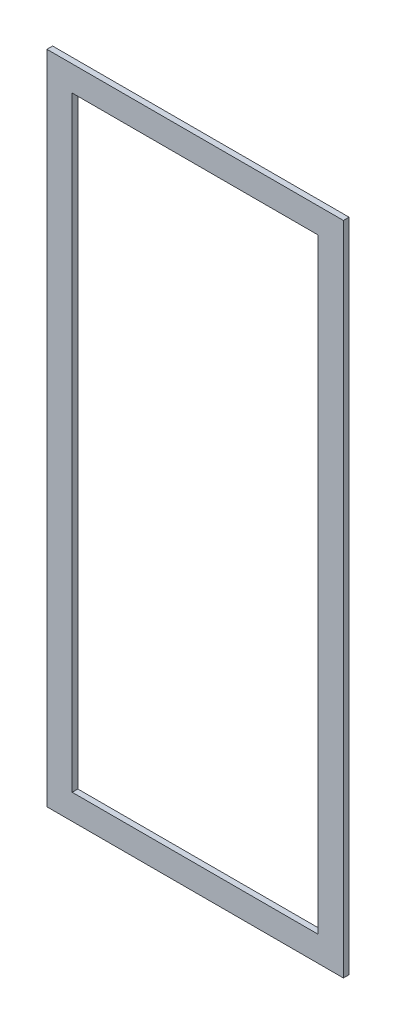
from build123d import *

# Parameters (mm, degrees)
ESBO_O1_W                = 94
ESBO_O1_H                = 208
ESBO_O1_W_2              = 78
ESBO_O1_H_2              = 192
RESSALTO_EXTRUS_O1_DEPTH = 1.8


with BuildPart() as part:
    # Esboço1 → Ressalto-extrusão1 (new body)
    with BuildSketch(Plane.XY):
        Rectangle(ESBO_O1_W, ESBO_O1_H)
        Rectangle(ESBO_O1_W_2, ESBO_O1_H_2, mode=Mode.SUBTRACT)
    extrude(amount=RESSALTO_EXTRUS_O1_DEPTH)


solid = part.part
